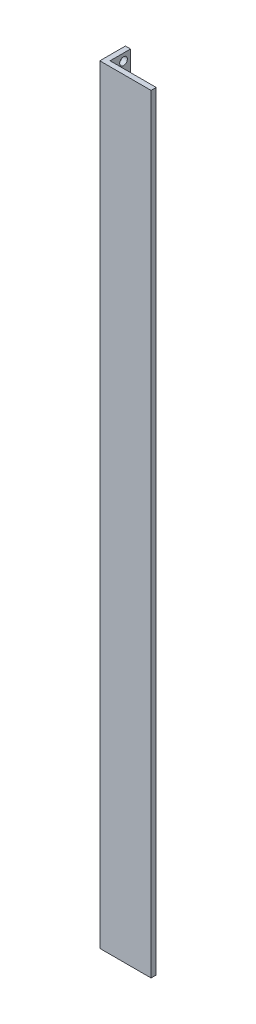
from build123d import *

# Parameters (mm, degrees)
BOSS_EXTRUDE1_DEPTH      = 300
SKETCH2_R                = 1.5
CUT_EXTRUDE1_DEPTH       = 301.83217913
F_3_0_3_DIAMETER_HOLE1_D = 3


with BuildPart() as part:
    # Sketch1 → Boss-Extrude1 (new body)
    with BuildSketch(Plane(origin=(0, 0, 0), x_dir=(1, 0, 0), z_dir=(0, 1, 0))):
        Polygon((0, 0), (0, 10), (2, 10), (2, 2), (20, 2), (20, 0), align=None)
    extrude(amount=BOSS_EXTRUDE1_DEPTH)

    # Sketch2 → Cut-Extrude1 (cut, through all)
    with BuildSketch(Plane.ZY):
        with Locations((-7.262612197, 297.245406858)):
            Circle(SKETCH2_R)
        with Locations((-7.258467028, 88.743438507)):
            Circle(SKETCH2_R)
    extrude(amount=-CUT_EXTRUDE1_DEPTH, mode=Mode.SUBTRACT)

    # Ø3.0 (3) Diameter Hole1 (through all)
    with Locations(Plane(origin=(2, -25.407632793, 52.861996081), x_dir=(0, 0, -1), z_dir=(1, 0, 0))):
        with Locations((58.861996081, 61.407632793), (58.861996081, 37.407632793)):
            Hole(F_3_0_3_DIAMETER_HOLE1_D / 2)


solid = part.part
